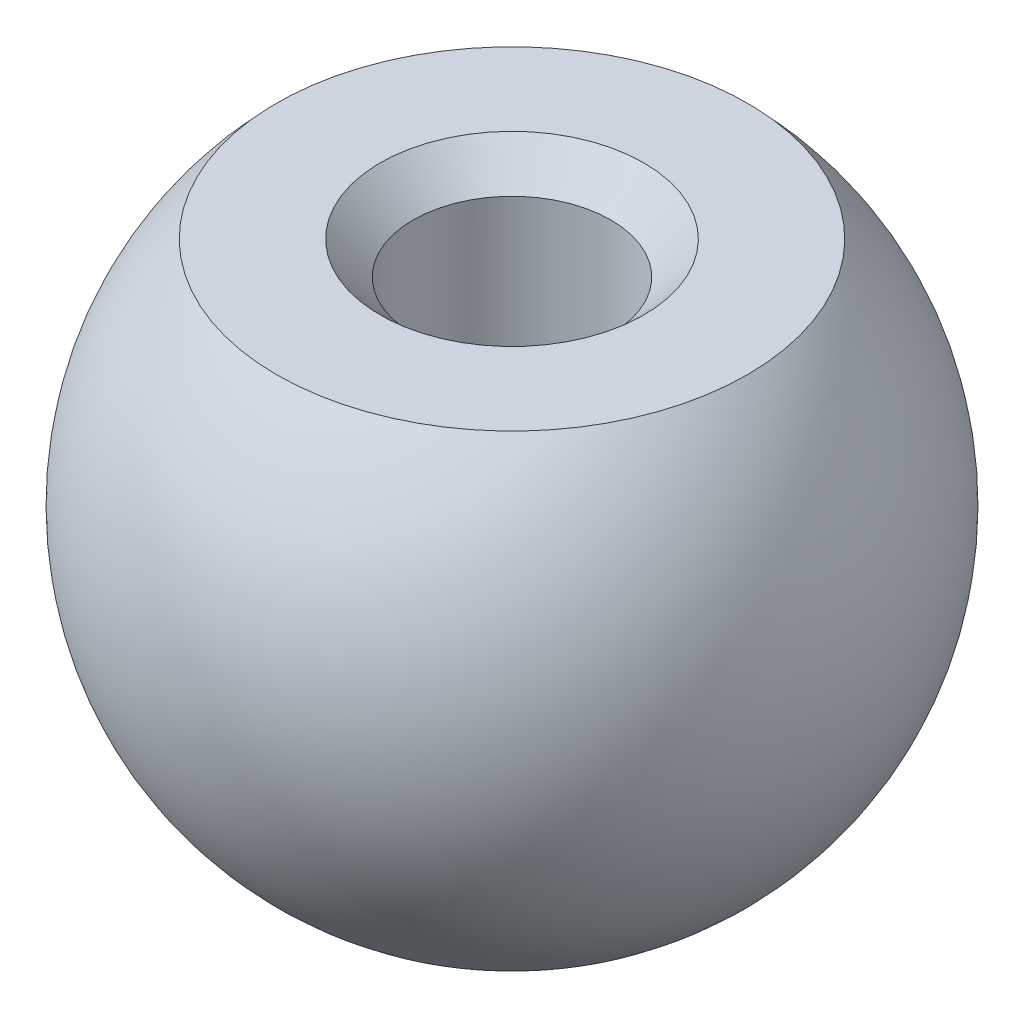
from build123d import *

# Parameters (mm, degrees)
SCHIZZO3_R               = 1.5
TAGLIO_ESTRUSIONE1_DEPTH = 6
SMUSSO1_SIZE             = 0.5


with BuildPart() as part:
    # Schizzo1 → Rivoluzione1 (revolve)
    with BuildSketch(Plane.XY):
        with BuildLine():
            Line((0, 5), (0, -5))
            ThreePointArc((0, -5), (-5, 0), (0, 5))
        make_face()
    revolve(axis=Axis((0, 5, 0), (0, -1, 0)))

    # Schizzo2 → Taglia-Rivoluzione1 (revolve, cut)
    with BuildSketch(Plane.XY, mode=Mode.PRIVATE) as taglia_rivoluzione1_sk:
        with BuildLine():
            Line((0, 3.5), (-3.570714214, 3.5))
            ThreePointArc((-3.570714214, 3.5), (-1.936491673, 4.609772229), (0, 5))
            Line((0, 5), (0, 3.5))
        make_face()
    revolve(taglia_rivoluzione1_sk.sketch.rotate(Axis((0, 5, 0), (0, -1, 0)), 180), axis=Axis((0, 5, 0), (0, -1, 0)), mode=Mode.SUBTRACT)

    # Schizzo3 → Taglio-Estrusione1 (cut)
    with BuildSketch(Plane(origin=(0, 3.5, 0), x_dir=(1, 0, 0), z_dir=(0, 1, 0))):
        with Locations(Location((0, 0, 0), (0, 0, 270))):
            Circle(SCHIZZO3_R)
    extrude(amount=-TAGLIO_ESTRUSIONE1_DEPTH, mode=Mode.SUBTRACT)

    # Smusso1
    smusso1_edges = [part.edges().sort_by_distance(p)[0] for p in [
        (0, 3.5, -1.5),
    ]]
    chamfer(smusso1_edges, length=SMUSSO1_SIZE)


solid = part.part
